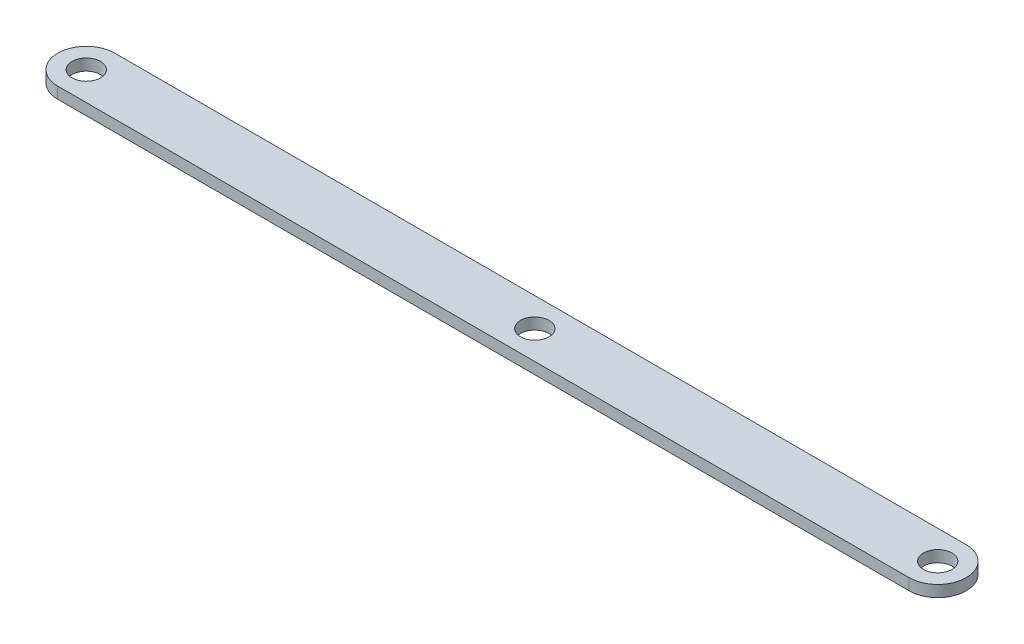
from build123d import *

# Parameters (mm, degrees)
SKETCH2_R           = 6.35
BOSS_EXTRUDE1_DEPTH = 5.08


with BuildPart() as part:
    # Sketch2 → Boss-Extrude1 (new body)
    with BuildSketch(Plane(origin=(0, 0, 0), x_dir=(1, 0, 0), z_dir=(0, 1, 0))):
        with BuildLine():
            Line((-378.9, 12.7), (0, 12.7))
            ThreePointArc((0, 12.7), (12.7, 0), (0, -12.7))
            Line((0, -12.7), (-378.9, -12.7))
            ThreePointArc((-378.9, -12.7), (-391.6, 0), (-378.9, 12.7))
        make_face()
        with Locations(Location((0, 0, 0), (0, 0, 270))):
            Circle(SKETCH2_R, mode=Mode.SUBTRACT)
        with Locations(Location((-179.3, 0, 0), (0, 0, 270))):
            Circle(SKETCH2_R, mode=Mode.SUBTRACT)
        with Locations(Location((-378.9, 0, 0), (0, 0, 270))):
            Circle(SKETCH2_R, mode=Mode.SUBTRACT)
    extrude(amount=BOSS_EXTRUDE1_DEPTH)


solid = part.part
